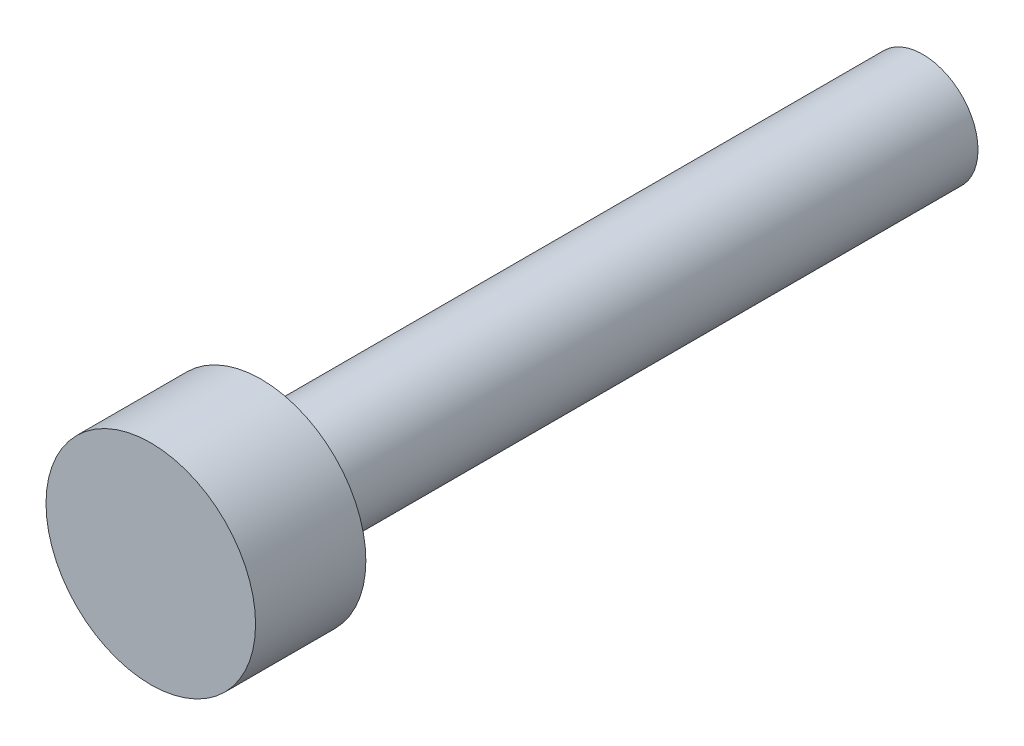
from build123d import *

# Parameters (mm, degrees)
M2X0P4_THREAD_ENVELOPE_L12_START = -12
SKETCH1_R                        = 1
M2X0P4_THREAD_ENVELOPE_L12_DEPTH = 12
SKETCH2_R                        = 1.9
HEAD_D3P8_H2_DEPTH               = 2


with BuildPart() as part:
    # Sketch1 → M2x0p4_Thread_Envelope_L12 (new body)
    with BuildSketch(Plane.XY.offset(M2X0P4_THREAD_ENVELOPE_L12_START)):
        Circle(SKETCH1_R)
    extrude(amount=M2X0P4_THREAD_ENVELOPE_L12_DEPTH)

    # Sketch2 → Head_D3p8_H2 (add)
    with BuildSketch(Plane.XY):
        Circle(SKETCH2_R)
    extrude(amount=HEAD_D3P8_H2_DEPTH)


solid = part.part
